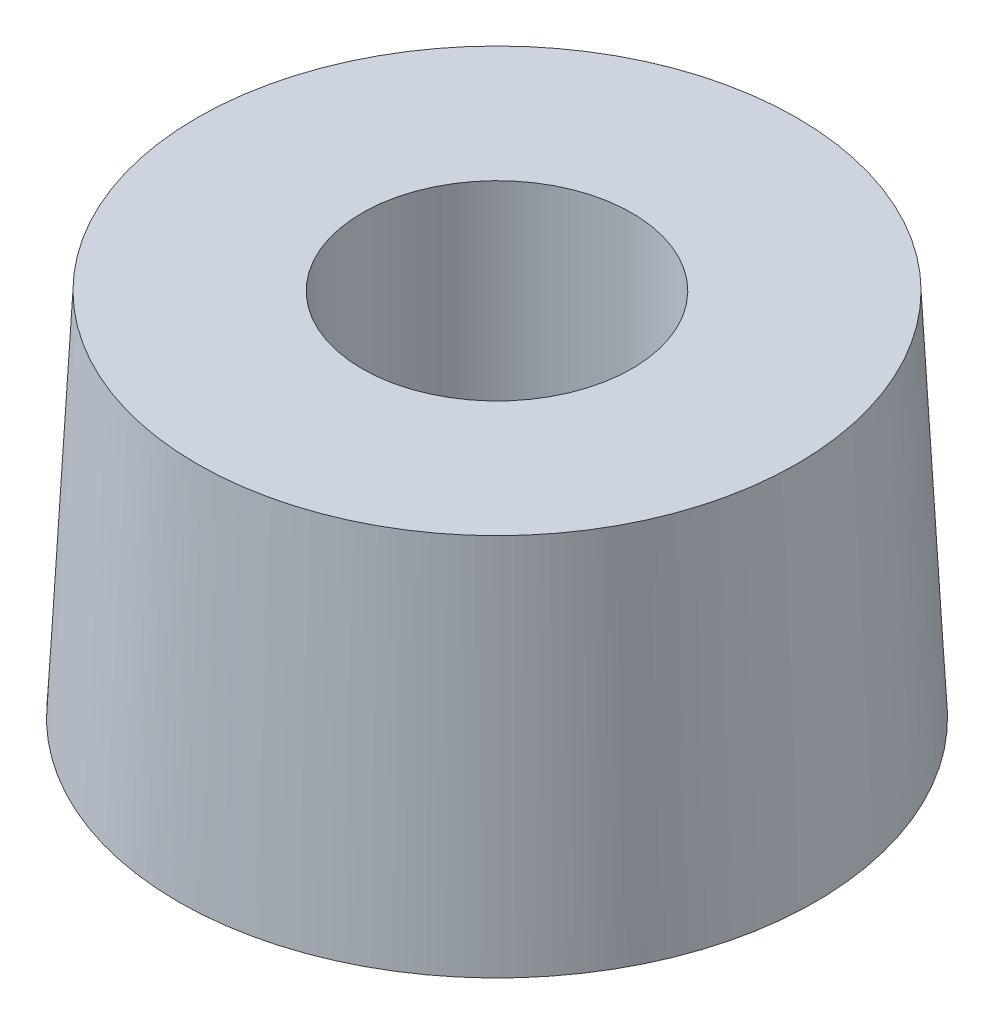
from build123d import *

# Parameters (mm, degrees)
SKETCH_3_R          = 12
SKETCH_1_R          = 12.75
SKETCH_4_R          = 5.4
CUT_EXTRUDE_1_DEPTH = 24.327344642


with BuildPart() as part:
    # 草图3 → 放样1 section 0
    with BuildSketch(Plane(origin=(0, 14.8, 0), x_dir=(1, 0, 0), z_dir=(0, 1, 0))):
        Circle(SKETCH_3_R)
    # 草图1 → 放样1 section 1
    with BuildSketch(Plane(origin=(0, 0, 0), x_dir=(1, 0, 0), z_dir=(0, 1, 0))):
        Circle(SKETCH_1_R)
    loft()

    # 草图4 → 切除-拉伸1 (cut, through all)
    with BuildSketch(Plane(origin=(0, 14.8, 0), x_dir=(1, 0, 0), z_dir=(0, 1, 0))):
        with Locations(Location((0, 0, 0), (0, 0, 270))):
            Circle(SKETCH_4_R)
    extrude(amount=-CUT_EXTRUDE_1_DEPTH, mode=Mode.SUBTRACT)


solid = part.part
